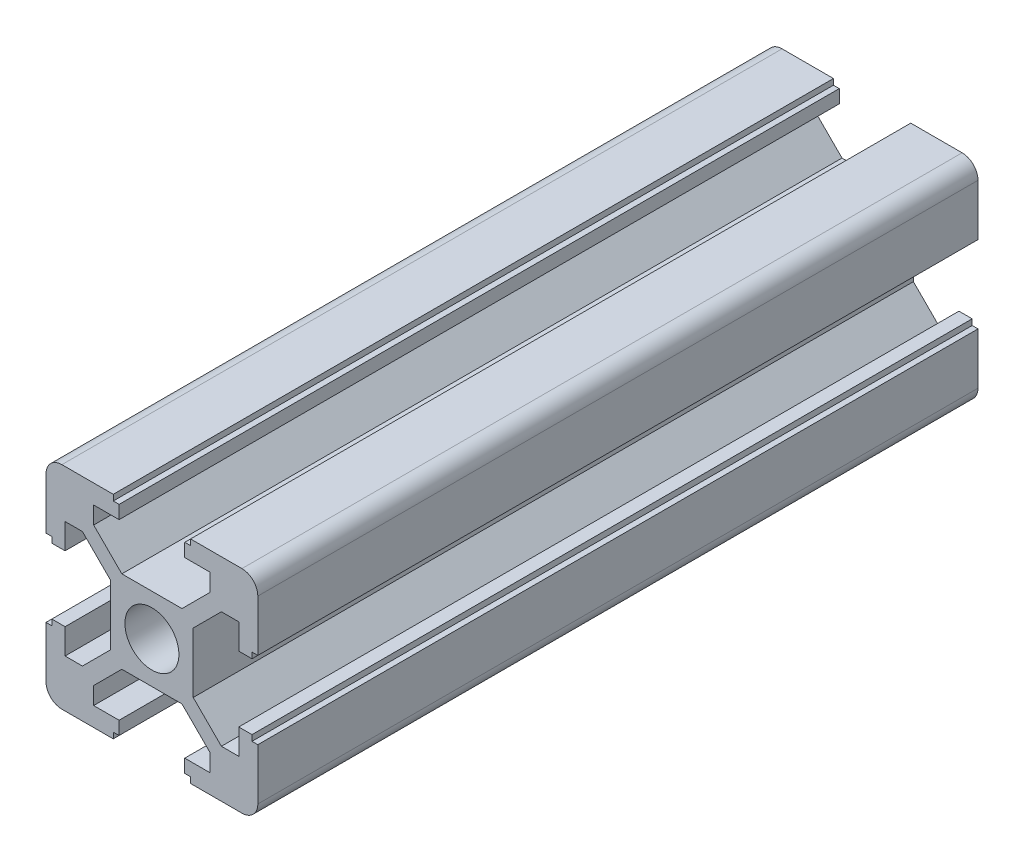
from build123d import *

# Parameters (mm, degrees)
SKETCH_1_R      = 2.55
EXTRUDE_1_DEPTH = 68


with BuildPart() as part:
    # 草图1 → 凸台-拉伸1 (new body)
    with BuildSketch(Plane.XY):
        with BuildLine():
            Line((-3.9, 2.839339828), (-6.560660172, 5.5))
            Line((-6.560660172, 5.5), (-8.2, 5.5))
            Line((-8.2, 5.5), (-8.2, 3.1))
            Line((-8.2, 3.1), (-9.45, 3.1))
            Line((-9.45, 3.1), (-9.45, 3.65))
            Line((-9.45, 3.65), (-10, 3.65))
            Line((-10, 3.65), (-10, 8.5))
            ThreePointArc((-10, 8.5), (-9.560660172, 9.560660172), (-8.5, 10))
            Line((-8.5, 10), (-3.65, 10))
            Line((-3.65, 10), (-3.65, 9.45))
            Line((-3.65, 9.45), (-3.1, 9.45))
            Line((-3.1, 9.45), (-3.1, 8.2))
            Line((-3.1, 8.2), (-5.5, 8.2))
            Line((-5.5, 8.2), (-5.5, 6.560660172))
            Line((-5.5, 6.560660172), (-2.839339828, 3.9))
            Line((-2.839339828, 3.9), (2.839339828, 3.9))
            Line((2.839339828, 3.9), (5.5, 6.560660172))
            Line((5.5, 6.560660172), (5.5, 8.2))
            Line((5.5, 8.2), (3.1, 8.2))
            Line((3.1, 8.2), (3.1, 9.45))
            Line((3.1, 9.45), (3.65, 9.45))
            Line((3.65, 9.45), (3.65, 10))
            Line((3.65, 10), (8.5, 10))
            ThreePointArc((8.5, 10), (9.560660172, 9.560660172), (10, 8.5))
            Line((10, 8.5), (10, 3.65))
            Line((10, 3.65), (9.45, 3.65))
            Line((9.45, 3.65), (9.45, 3.1))
            Line((9.45, 3.1), (8.2, 3.1))
            Line((8.2, 3.1), (8.2, 5.5))
            Line((8.2, 5.5), (6.560660172, 5.5))
            Line((6.560660172, 5.5), (3.9, 2.839339828))
            Line((3.9, 2.839339828), (3.9, -2.839339828))
            Line((3.9, -2.839339828), (6.560660172, -5.5))
            Line((6.560660172, -5.5), (8.2, -5.5))
            Line((8.2, -5.5), (8.2, -3.1))
            Line((8.2, -3.1), (9.45, -3.1))
            Line((9.45, -3.1), (9.45, -3.65))
            Line((9.45, -3.65), (10, -3.65))
            Line((10, -3.65), (10, -8.5))
            ThreePointArc((10, -8.5), (9.560660172, -9.560660172), (8.5, -10))
            Line((8.5, -10), (3.65, -10))
            Line((3.65, -10), (3.65, -9.45))
            Line((3.65, -9.45), (3.1, -9.45))
            Line((3.1, -9.45), (3.1, -8.2))
            Line((3.1, -8.2), (5.5, -8.2))
            Line((5.5, -8.2), (5.5, -6.560660172))
            Line((5.5, -6.560660172), (2.839339828, -3.9))
            Line((2.839339828, -3.9), (-2.839339828, -3.9))
            Line((-2.839339828, -3.9), (-5.5, -6.560660172))
            Line((-5.5, -6.560660172), (-5.5, -8.2))
            Line((-5.5, -8.2), (-3.1, -8.2))
            Line((-3.1, -8.2), (-3.1, -9.45))
            Line((-3.1, -9.45), (-3.65, -9.45))
            Line((-3.65, -9.45), (-3.65, -10))
            Line((-3.65, -10), (-8.5, -10))
            ThreePointArc((-8.5, -10), (-9.560660172, -9.560660172), (-10, -8.5))
            Line((-10, -8.5), (-10, -3.65))
            Line((-10, -3.65), (-9.45, -3.65))
            Line((-9.45, -3.65), (-9.45, -3.1))
            Line((-9.45, -3.1), (-8.2, -3.1))
            Line((-8.2, -3.1), (-8.2, -5.5))
            Line((-8.2, -5.5), (-6.560660172, -5.5))
            Line((-6.560660172, -5.5), (-3.9, -2.839339828))
            Line((-3.9, -2.839339828), (-3.9, 2.839339828))
        make_face()
        Circle(SKETCH_1_R, mode=Mode.SUBTRACT)
    extrude(amount=EXTRUDE_1_DEPTH)


solid = part.part
